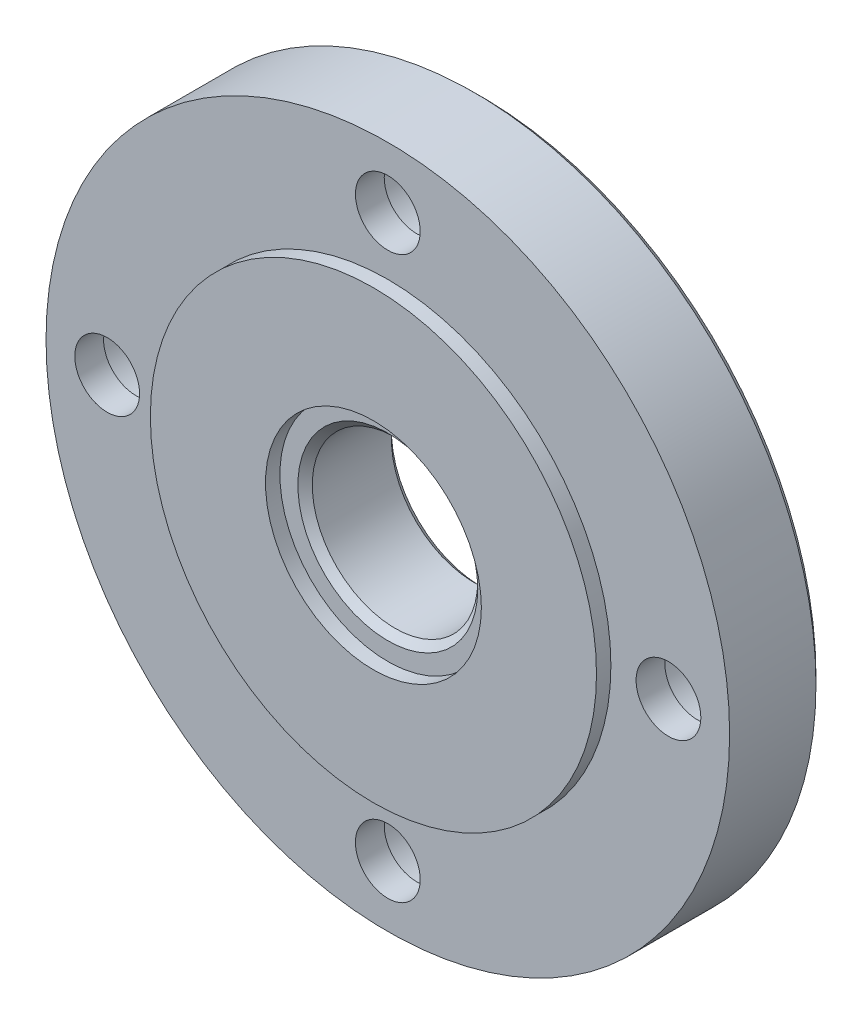
from build123d import *

# Parameters (mm, degrees)
SKETCH_1_R               = 47.5
EXTRUDE_1_DEPTH          = 13
SKETCH_2_R               = 31
EXTRUDE_2_DEPTH          = 2
SKETCH_3_R               = 15
CUT_EXTRUDE_2_DEPTH      = 2
SKETCH_6_R               = 11.5
CUT_EXTRUDE_3_DEPTH      = 69.421487853
CHAMFER_1_SIZE           = 1
SKETCH_7_R               = 7
CUT_EXTRUDE_4_DEPTH      = 9
SKETCH_8_R               = 4.5
CUT_EXTRUDE_5_DEPTH      = 68.775364256
PATTERN_CIRCULAR_1_COUNT = 4
CHAMFER_2_SIZE           = 1


with BuildPart() as part:
    # 草图1 → 凸台-拉伸1 (new body)
    with BuildSketch(Plane.XY):
        with Locations(Location((0, 0, 0), (0, 0, 180))):
            Circle(SKETCH_1_R)
    extrude(amount=EXTRUDE_1_DEPTH)

    # 草图2 → 凸台-拉伸2 (add)
    with BuildSketch(Plane.XY.offset(13)):
        Circle(SKETCH_2_R)
    extrude(amount=EXTRUDE_2_DEPTH)

    # 草图3 → 切除-拉伸2 (cut)
    with BuildSketch(Plane.XY.offset(15)):
        Circle(SKETCH_3_R)
    extrude(amount=-CUT_EXTRUDE_2_DEPTH, mode=Mode.SUBTRACT)

    # 草图6 → 切除-拉伸3 (cut, through all)
    with BuildSketch(Plane.XY.offset(13)):
        Circle(SKETCH_6_R)
    extrude(amount=-CUT_EXTRUDE_3_DEPTH, mode=Mode.SUBTRACT)

    # 倒角1
    chamfer_1_edges = [part.edges().sort_by_distance(p)[0] for p in [
        (-11.5, 0, 0),
        (-11.5, 0, 13),
    ]]
    chamfer(chamfer_1_edges, length=CHAMFER_1_SIZE)

    # 草图7 → 切除-拉伸4 (cut)
    with BuildSketch(Plane(origin=(0, 0, 0), x_dir=(-1, 0, 0), z_dir=(0, 0, -1))):
        with Locations((0, 39)):
            Circle(SKETCH_7_R)
    cut_extrude_4 = extrude(amount=-CUT_EXTRUDE_4_DEPTH, mode=Mode.SUBTRACT)

    # 草图8 → 切除-拉伸5 (cut, through all)
    with BuildSketch(Plane(origin=(0, 0, 9), x_dir=(-1, 0, 0), z_dir=(0, 0, -1))):
        with Locations((0, 39)):
            Circle(SKETCH_8_R)
    cut_extrude_5 = extrude(amount=-CUT_EXTRUDE_5_DEPTH, mode=Mode.SUBTRACT)

    # 阵列(圆周)1: 切除-拉伸4, 切除-拉伸5 ×4 about axis
    pattern_circular_1_axis = Axis((0, 0, 0), (0, 0, 1))
    add([cut_extrude_4.rotate(pattern_circular_1_axis, i * 360 / PATTERN_CIRCULAR_1_COUNT) for i in range(1, PATTERN_CIRCULAR_1_COUNT)], mode=Mode.SUBTRACT)
    add([cut_extrude_5.rotate(pattern_circular_1_axis, i * 360 / PATTERN_CIRCULAR_1_COUNT) for i in range(1, PATTERN_CIRCULAR_1_COUNT)], mode=Mode.SUBTRACT)

    # 倒角2
    chamfer_2_edges = [part.edges().sort_by_distance(p)[0] for p in [
        (47.5, 0, 0),
    ]]
    chamfer(chamfer_2_edges, length=CHAMFER_2_SIZE)


solid = part.part
